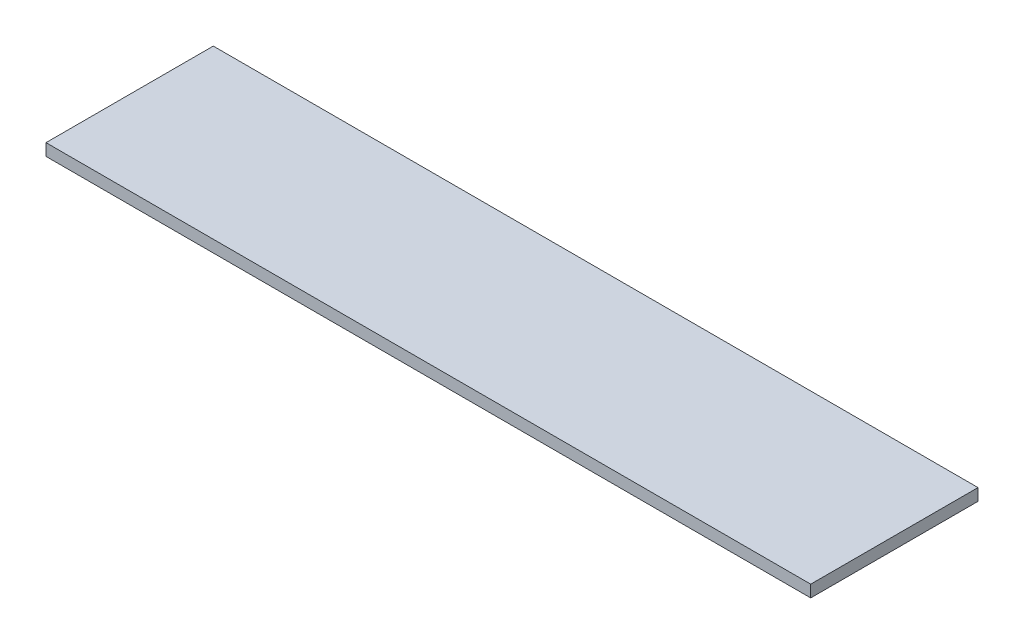
from build123d import *

# Parameters (mm, degrees)
SKETCH1_W           = 1219.2
SKETCH1_H           = 266.7
BOSS_EXTRUDE1_DEPTH = 19.05


with BuildPart() as part:
    # Sketch1 → Boss-Extrude1 (new body)
    with BuildSketch(Plane(origin=(0, 0, 0), x_dir=(1, 0, 0), z_dir=(0, 1, 0))):
        with Locations((609.6, 133.35)):
            Rectangle(SKETCH1_W, SKETCH1_H)
    extrude(amount=BOSS_EXTRUDE1_DEPTH)


solid = part.part
